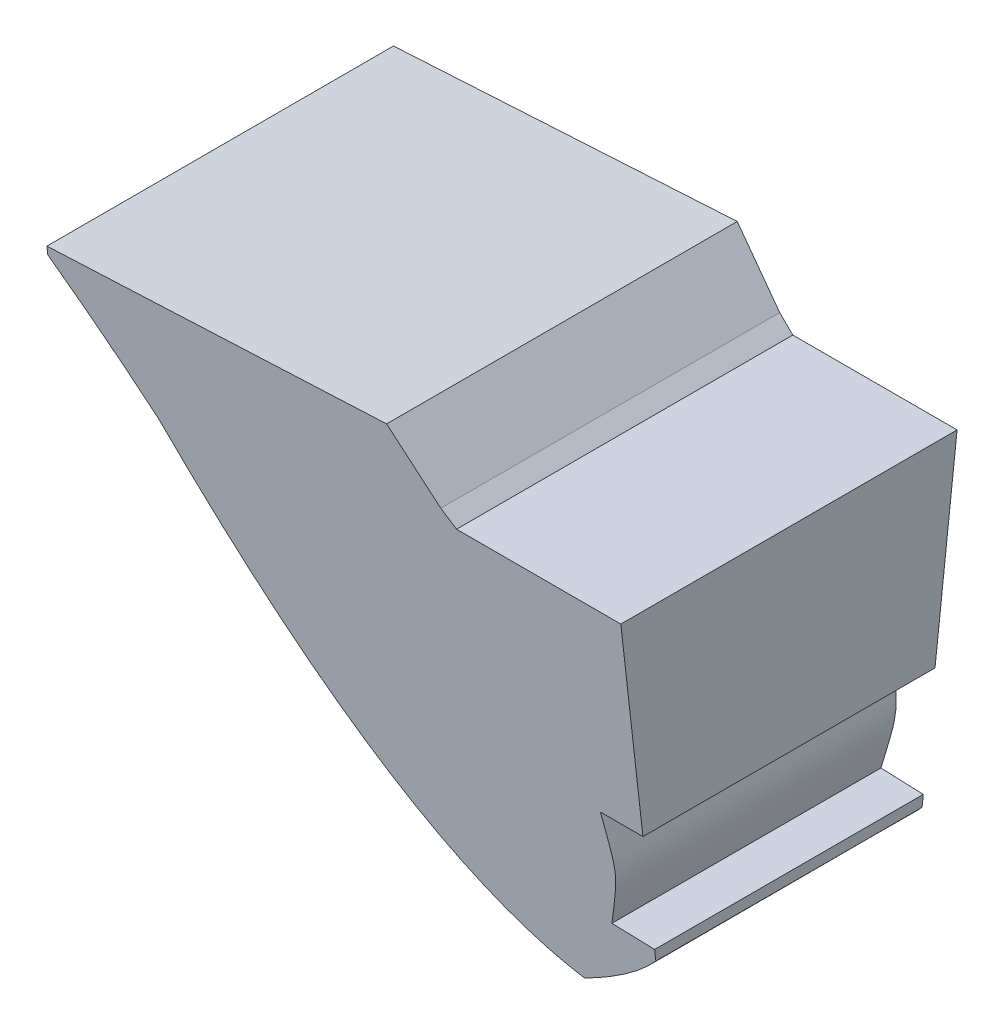
from build123d import *

# Parameters (mm, degrees)
SALIENTE_EXTRUIR1_DEPTH             = 7.21
SALIENTE_EXTRUIR2_DEPTH             = 7.21
SALIENTE_EXTRUIR2_DEPTH_BACK        = 7.21
CORTAR_EXTRUIR2_DEPTH               = 28.232395202
CORTAR_EXTRUIR2_DEPTH_BACK          = 28.232395202
SALIENTE_EXTRUIR3_REACH             = 29.232
SALIENTE_EXTRUIR3_DIRECTION_2_REACH = 29.232


with BuildPart() as part:
    # Croquis1 → Saliente-Extruir1 (new, symmetric)
    with BuildSketch(Plane.XY):
        with BuildLine():
            add(Edge.make_bspline(
                [(-18.945192114, 7.540918896), (-10.215008384, -3.697644103), (-2.846604825, -5.059081104)],
                knots=[0.497667241, 0.497667241, 0.497667241, 0.49955428, 0.49955428, 0.49955428], degree=2, weights=[1, 1, 1]))
            add(Edge.make_bspline(
                [(-2.846604825, -5.059081104), (-0.742366882, -3.9352066), (0.355125, -2.723253227)],
                knots=[0.498812075, 0.498812075, 0.498812075, 0.499412845, 0.499412845, 0.499412845], degree=2, weights=[1, 1, 1]))
            Line((0.355125, -2.723253227), (0.355125, -2.284841781))
            Line((0.355125, -2.284841781), (-1.394875, -2.223730435))
            add(Edge.make_bspline(
                [(-1.394875, -2.223730435), (-0.90753067, -0.123730435), (-1.394875, 1.976269565)],
                knots=[0, 0, 0, 1, 1, 1], degree=2, weights=[1, 3.231801219, 1]))
            Line((-1.394875, 1.976269565), (0.355125, 2.284841781))
            Line((0.355125, 2.284841781), (0.355125, 3.001549529))
            add(Edge.make_bspline(
                [(0.355125, 3.001549529), (-1.44872627, 6.058427314), (-6.994875026, 10.477389992)],
                knots=[0.500820705, 0.500820705, 0.500820705, 0.502013312, 0.502013312, 0.502013312], degree=2, weights=[1, 1, 1]))
            Line((-6.994875026, 10.477389992), (-8.981845695, 12.608155172))
            Line((-8.981845695, 12.608155172), (-23.035921146, 11.871612288))
            Line((-23.035921146, 11.871612288), (-23.035921146, 11.54013782))
            ThreePointArc((-23.035921146, 11.54013782), (-20.949684518, 9.582335705), (-18.945192114, 7.540918896))
        make_face()
    extrude(amount=SALIENTE_EXTRUIR1_DEPTH, both=True)

    # Croquis4 → Saliente-Extruir2 (add, two sides: drawn at the far end of the back side and taken through both)
    with BuildSketch(Plane.XY.offset(-SALIENTE_EXTRUIR2_DEPTH_BACK)):
        Polygon((-1.394875, 1.976269565), (0.355125, 2.284841781), (0.355125, 1.976269565), align=None)
    extrude(amount=SALIENTE_EXTRUIR2_DEPTH + SALIENTE_EXTRUIR2_DEPTH_BACK)

    # Croquis6 → Cortar-Extruir2 (cut, two sides: drawn at the far end of the back side and taken through both)
    with BuildSketch(Plane(origin=(0, 0, 0), x_dir=(0, 0, -1), z_dir=(1, 0, 0)).offset(-CORTAR_EXTRUIR2_DEPTH_BACK)):
        Polygon((7.21, 12.608155172), (7.21, -5.059081104), (5.21, -5.059081104), align=None)
        Polygon((-7.21, 12.608155172), (-7.21, -5.059081104), (-5.21, -5.059081104), align=None)
    extrude(amount=CORTAR_EXTRUIR2_DEPTH + CORTAR_EXTRUIR2_DEPTH_BACK, mode=Mode.SUBTRACT)

    # Saliente-Extruir3: up to this plane
    saliente_extruir3_end = Plane(origin=(-23.035921146, 12.608155172, 7.21), z_dir=(0, 0.1124854344122626, -0.9936533736897816))
    # Croquis8 → Saliente-Extruir3 (add, up to the surface)
    with BuildSketch(Plane.XY, mode=Mode.PRIVATE) as saliente_extruir3_sk1:
        with BuildLine():
            Line((-6.40174466, 10), (0.355125, 10))
            Line((0.355125, 10), (0.355125, 3.001549529))
            add(Edge.make_bspline(
                [(-6.40174466, 10), (-1.350464373, 5.891908813), (0.355125, 3.001549529)],
                knots=[0.50088567, 0.50088567, 0.50088567, 0.502013312, 0.502013312, 0.502013312], degree=2, weights=[1, 1, 1]))
        make_face()
    saliente_extruir3_tool1 = split(extrude(saliente_extruir3_sk1.sketch, amount=SALIENTE_EXTRUIR3_REACH, mode=Mode.PRIVATE), bisect_by=saliente_extruir3_end, keep=Keep.BOTH, mode=Mode.PRIVATE)
    add(saliente_extruir3_tool1.solids().sort_by_distance((-1.802267, 7.821617, 0))[0])

    # Saliente-Extruir3 direction 2: up to this plane
    saliente_extruir3_direction_2_end = Plane(origin=(-23.035921146, 12.608155172, -7.21), z_dir=(0, 0.1124854344122626, 0.9936533736897816))
    # Croquis8 → Saliente-Extruir3 direction 2 (add, up to the surface)
    with BuildSketch(Plane.XY, mode=Mode.PRIVATE) as saliente_extruir3_direction_2_sk1:
        with BuildLine():
            Line((-6.40174466, 10), (0.355125, 10))
            Line((0.355125, 10), (0.355125, 3.001549529))
            add(Edge.make_bspline(
                [(-6.40174466, 10), (-1.350464373, 5.891908813), (0.355125, 3.001549529)],
                knots=[0.50088567, 0.50088567, 0.50088567, 0.502013312, 0.502013312, 0.502013312], degree=2, weights=[1, 1, 1]))
        make_face()
    saliente_extruir3_direction_2_tool1 = split(extrude(saliente_extruir3_direction_2_sk1.sketch, amount=-SALIENTE_EXTRUIR3_DIRECTION_2_REACH, mode=Mode.PRIVATE), bisect_by=saliente_extruir3_direction_2_end, keep=Keep.BOTH, mode=Mode.PRIVATE)
    add(saliente_extruir3_direction_2_tool1.solids().sort_by_distance((-1.802267, 7.821617, 0))[0])


solid = part.part
